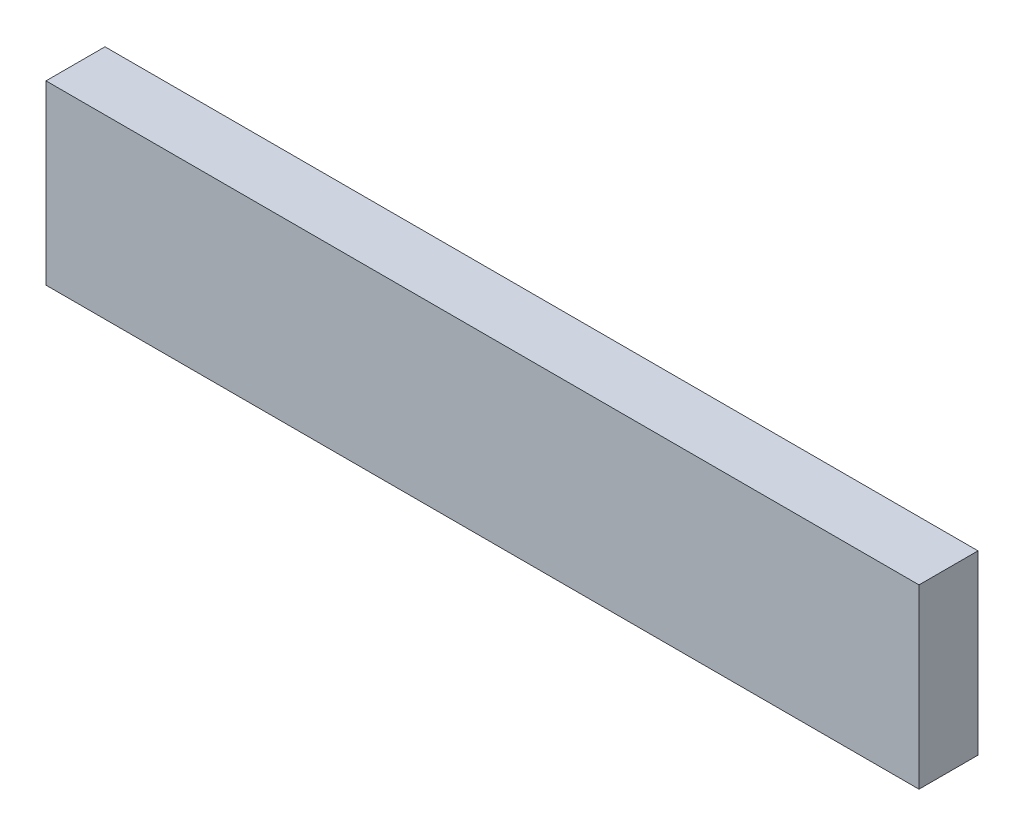
from build123d import *

# Parameters (mm, degrees)
SKETCH1_W           = 74
SKETCH1_H           = 15
BOSS_EXTRUDE1_DEPTH = 5


with BuildPart() as part:
    # Sketch1 → Boss-Extrude1 (new body)
    with BuildSketch(Plane.XY):
        Rectangle(SKETCH1_W, SKETCH1_H)
    extrude(amount=BOSS_EXTRUDE1_DEPTH)


solid = part.part
